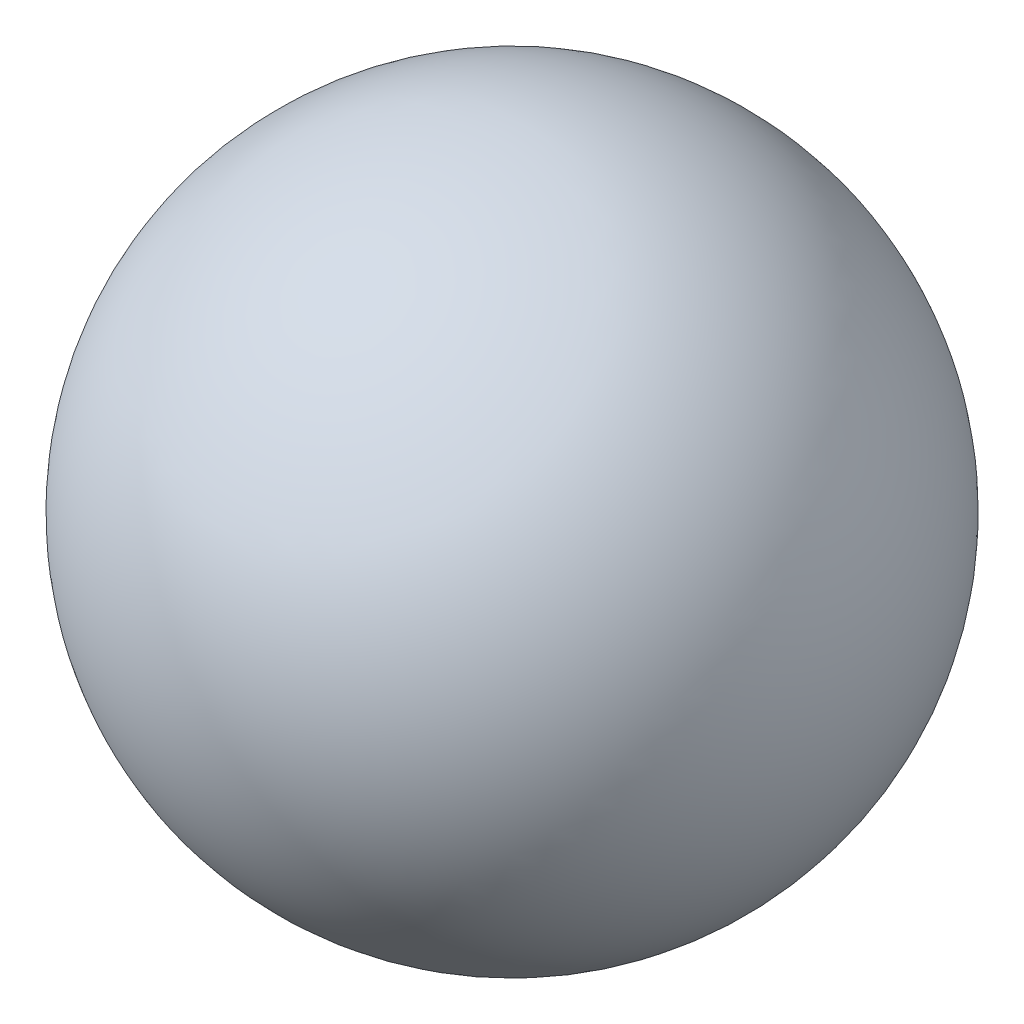
from build123d import *


with BuildPart() as part:
    # Sketch2 → Revolve1 (revolve)
    with BuildSketch(Plane(origin=(0, 0, 0), x_dir=(1, 0, 0), z_dir=(0, 1, 0))):
        with BuildLine():
            Line((0, 0), (0, 80))
            ThreePointArc((0, 80), (40, 40), (0, 0))
        make_face()
    revolve(axis=Axis((0, 0, 0), (0, 0, -1)))


solid = part.part
